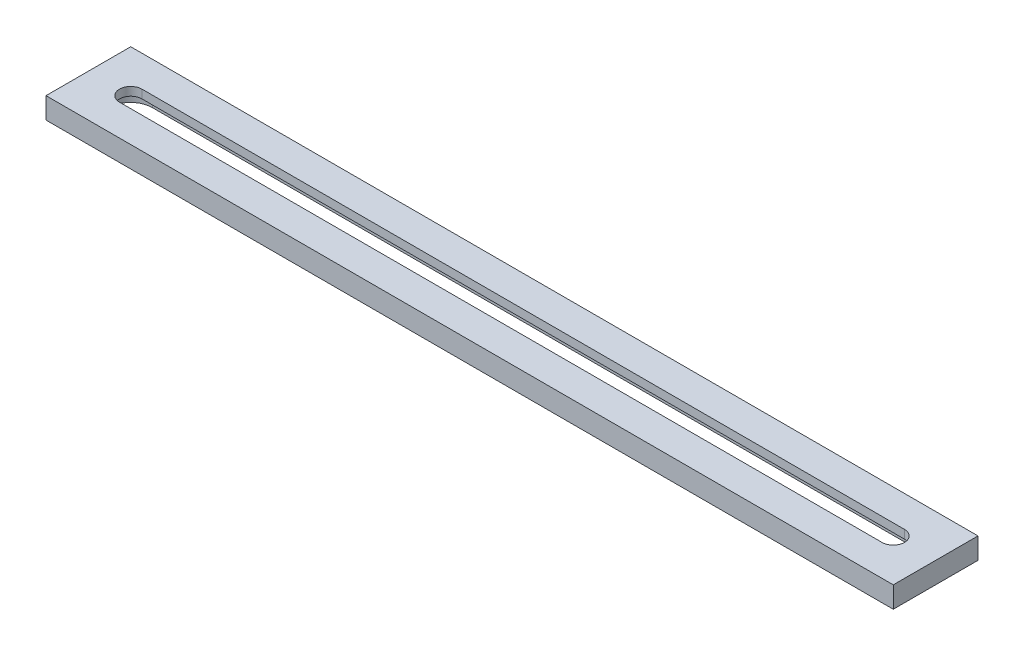
from build123d import *

# Parameters (mm, degrees)
SKETCH1_W           = 254
SKETCH1_H           = 25.4
BOSS_EXTRUDE1_DEPTH = 6.35
CUT_EXTRUDE1_DEPTH  = 128.791284914
CUT_EXTRUDE2_DEPTH  = 3.81


with BuildPart() as part:
    # Sketch1 → Boss-Extrude1 (new body)
    with BuildSketch(Plane(origin=(0, 0, 0), x_dir=(1, 0, 0), z_dir=(0, 1, 0))):
        Rectangle(SKETCH1_W, SKETCH1_H)
    extrude(amount=BOSS_EXTRUDE1_DEPTH)

    # Sketch2 → Cut-Extrude1 (cut, through all)
    with BuildSketch(Plane(origin=(0, 6.35, 0), x_dir=(1, 0, 0), z_dir=(0, 1, 0))):
        with BuildLine():
            Line((-114.3, 3.3782), (114.3, 3.3782))
            ThreePointArc((114.3, 3.3782), (117.6782, 0), (114.3, -3.3782))
            Line((114.3, -3.3782), (-114.3, -3.3782))
            ThreePointArc((-114.3, -3.3782), (-117.6782, 0), (-114.3, 3.3782))
        make_face()
    extrude(amount=-CUT_EXTRUDE1_DEPTH, mode=Mode.SUBTRACT)

    # Sketch3 → Cut-Extrude2 (cut)
    with BuildSketch(Plane.XZ):
        with BuildLine():
            Line((-114.3, 6.477), (114.3, 6.477))
            ThreePointArc((114.3, 6.477), (120.777, 0), (114.3, -6.477))
            Line((114.3, -6.477), (-114.3, -6.477))
            ThreePointArc((-114.3, -6.477), (-120.777, 0), (-114.3, 6.477))
        make_face()
    extrude(amount=-CUT_EXTRUDE2_DEPTH, mode=Mode.SUBTRACT)


solid = part.part
